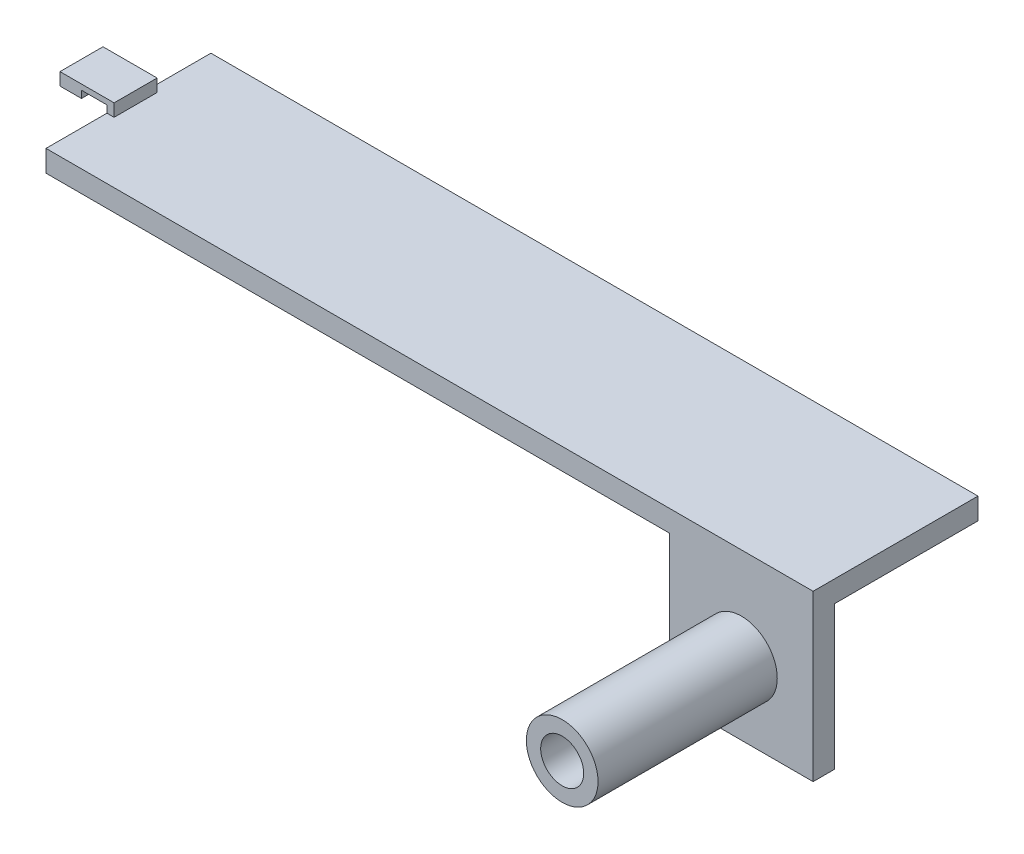
from build123d import *

# Parameters (mm, degrees)
BOSS_EXTRUDE1_DEPTH      = 107
SKETCH7_W                = 87
SKETCH7_H                = 20
CUT_EXTRUDE4_DEPTH       = 25
SKETCH8_R                = 5
SKETCH8_R_2              = 3
BOSS_EXTRUDE3_DEPTH      = 25
BOSS_EXTRUDE4_DEPTH      = 3
BOSS_EXTRUDE4_DEPTH_BACK = 3
BOSS_EXTRUDE4_START      = 11.5


with BuildPart() as part:
    # Sketch2 → Boss-Extrude1 (new body)
    with BuildSketch(Plane(origin=(0, 0, 0), x_dir=(0, 0, -1), z_dir=(1, 0, 0))):
        Polygon((0, 0), (-23, 0), (-23, -23), (-20, -23), (-20, -3), (0, -3), align=None)
    extrude(amount=-BOSS_EXTRUDE1_DEPTH)

    # Sketch7 → Cut-Extrude4 (cut)
    with BuildSketch(Plane.XY.offset(23)):
        with Locations((-63.5, -13)):
            Rectangle(SKETCH7_W, SKETCH7_H)
    extrude(amount=-CUT_EXTRUDE4_DEPTH, mode=Mode.SUBTRACT)

    # Sketch8 → Boss-Extrude3 (add)
    with BuildSketch(Plane.XY.offset(23)):
        with Locations((-10, -13)):
            Circle(SKETCH8_R)
        with Locations(Location((-10, -13, 0), (0, 0, 270))):
            Circle(SKETCH8_R_2, mode=Mode.SUBTRACT)
    extrude(amount=BOSS_EXTRUDE3_DEPTH)

    # Sketch9 → Boss-Extrude4 (add, two sides: drawn at the far end of the back side and taken through both)
    with BuildSketch(Plane.XY.offset(BOSS_EXTRUDE4_START - BOSS_EXTRUDE4_DEPTH_BACK)):
        Polygon((-107, 0), (-107, 1), (-110.55, 1), (-110.55, 0), (-113.55, 0), (-113.55, 1.75), (-110.55, 1.75), (-106, 1.75), (-106, 0), align=None)
    extrude(amount=BOSS_EXTRUDE4_DEPTH + BOSS_EXTRUDE4_DEPTH_BACK)


solid = part.part
